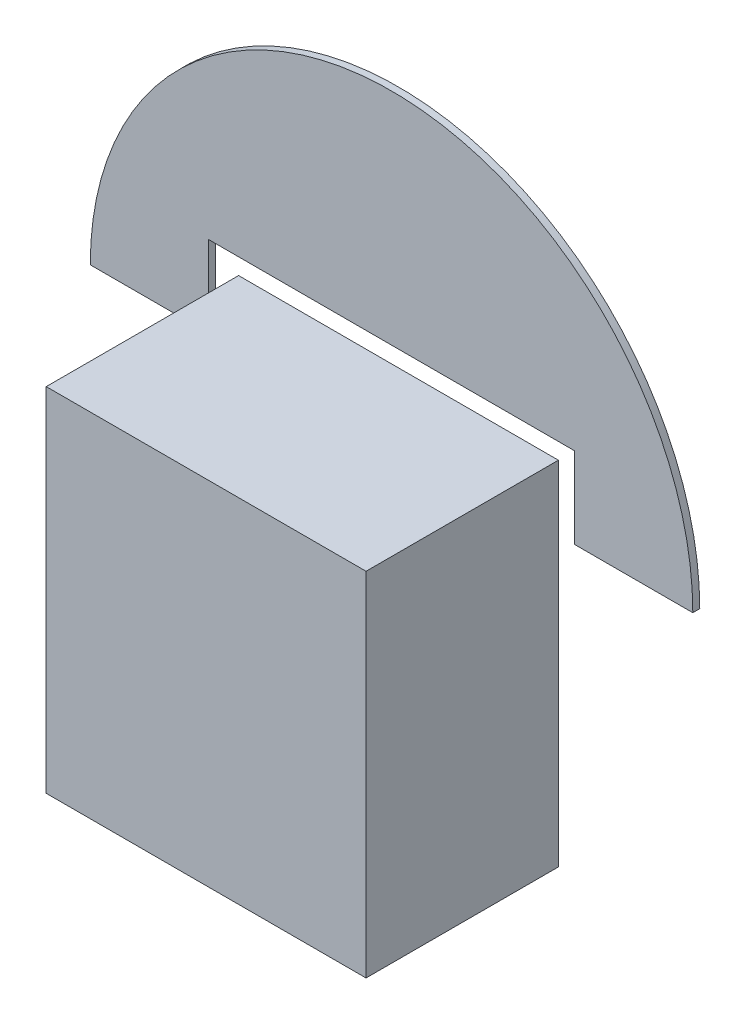
from build123d import *

# Parameters (mm, degrees)
SKETCH2_W           = 1380
SKETCH2_H           = 1520
BOSS_EXTRUDE3_DEPTH = 830
BOSS_EXTRUDE4_DEPTH = 30


with BuildPart() as part:
    # Sketch2 → Boss-Extrude3 (new body)
    with BuildSketch(Plane.XY):
        with Locations((23.262557024, 22.44080113)):
            Rectangle(SKETCH2_W, SKETCH2_H)
    extrude(amount=BOSS_EXTRUDE3_DEPTH)


with BuildPart() as body_2:
    # Sketch3 → Boss-Extrude4 (new body)
    with BuildSketch(Plane.XY):
        with BuildLine():
            ThreePointArc((1323.262557024, 532.44080113), (23.262557024, 1832.44080113), (-1276.737442976, 532.44080113))
            Line((-1276.737442976, 532.44080113), (-766.737442976, 532.44080113))
            Line((-766.737442976, 532.44080113), (-766.737442976, 882.44080113))
            Line((-766.737442976, 882.44080113), (813.262557024, 882.44080113))
            Line((813.262557024, 882.44080113), (813.262557024, 532.44080113))
            Line((813.262557024, 532.44080113), (1323.262557024, 532.44080113))
        make_face()
    extrude(amount=BOSS_EXTRUDE4_DEPTH)


solid = Compound([part.part, body_2.part])
